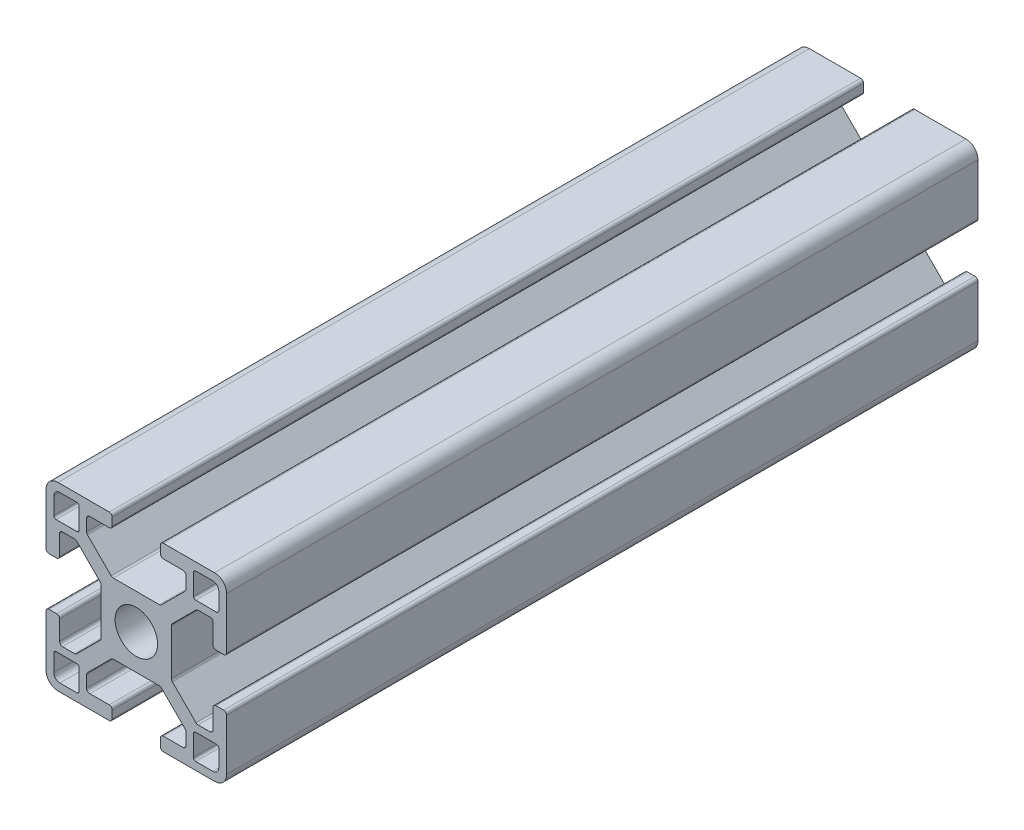
from build123d import *

# Parameters (mm, degrees)
SKETCH1_R           = 3.52998588
BOSS_EXTRUDE1_DEPTH = 62.39625


with BuildPart() as part:
    # Sketch1 → Boss-Extrude1 (new, symmetric)
    with BuildSketch(Plane.XY):
        with BuildLine():
            Line((14.49994, -4), (13.24247465, -4))
            ThreePointArc((13.24247465, -4), (12.88892126, -4.146446609), (12.74247465, -4.5))
            Line((12.74247465, -4.5), (12.74247465, -7.732519321))
            ThreePointArc((12.74247465, -7.732519321), (12.602449697, -8.097296796), (12.242781236, -8.249967))
            Line((12.242781236, -8.249967), (10.260188032, -8.249967))
            ThreePointArc((10.260188032, -8.249967), (10.068847082, -8.211906919), (9.906636056, -8.103520976))
            Line((9.906636056, -8.103520976), (5.981117769, -4.178002689))
            ThreePointArc((5.981117769, -4.178002689), (5.872731827, -4.015791664), (5.834671745, -3.824450713))
            Line((5.834671745, -3.824450713), (5.834671745, -1.01249595))
            Line((5.834671745, -1.01249595), (5.834671745, 0.88749645))
            Line((5.834671745, 0.88749645), (5.834671745, 3.824450713))
            ThreePointArc((5.834671745, 3.824450713), (5.872731827, 4.015791664), (5.981117769, 4.178002689))
            Line((5.981117769, 4.178002689), (9.906636056, 8.103520976))
            ThreePointArc((9.906636056, 8.103520976), (10.068847082, 8.211906919), (10.260188032, 8.249967))
            Line((10.260188032, 8.249967), (12.242781236, 8.249967))
            ThreePointArc((12.242781236, 8.249967), (12.602449697, 8.097296796), (12.74247465, 7.732519321))
            Line((12.74247465, 7.732519321), (12.74247465, 4.5))
            ThreePointArc((12.74247465, 4.5), (12.88892126, 4.146446609), (13.24247465, 4))
            Line((13.24247465, 4), (14.49994, 4))
            ThreePointArc((14.49994, 4), (14.853493391, 4.146446609), (14.99994, 4.5))
            Line((14.99994, 4.5), (14.99994, 12.999948))
            ThreePointArc((14.99994, 12.999948), (14.414155906, 14.414155906), (12.999948, 14.99994))
            Line((12.999948, 14.99994), (4.5, 14.99994))
            ThreePointArc((4.5, 14.99994), (4.146446609, 14.853493391), (4, 14.49994))
            Line((4, 14.49994), (4, 13.24247465))
            ThreePointArc((4, 13.24247465), (4.146446609, 12.88892126), (4.5, 12.74247465))
            Line((4.5, 12.74247465), (7.732519321, 12.74247465))
            ThreePointArc((7.732519321, 12.74247465), (8.097296796, 12.602449697), (8.249967, 12.242781236))
            Line((8.249967, 12.242781236), (8.249967, 10.260188032))
            ThreePointArc((8.249967, 10.260188032), (8.211906919, 10.068847082), (8.103520976, 9.906636056))
            Line((8.103520976, 9.906636056), (4.178002689, 5.981117769))
            ThreePointArc((4.178002689, 5.981117769), (4.015791664, 5.872731827), (3.824450713, 5.834671745))
            Line((3.824450713, 5.834671745), (0.9499962, 5.834671745))
            Line((0.9499962, 5.834671745), (-0.9499962, 5.834671745))
            Line((-0.9499962, 5.834671745), (-3.824450713, 5.834671745))
            ThreePointArc((-3.824450713, 5.834671745), (-4.015791664, 5.872731827), (-4.178002689, 5.981117769))
            Line((-4.178002689, 5.981117769), (-8.103520976, 9.906636056))
            ThreePointArc((-8.103520976, 9.906636056), (-8.211906919, 10.068847082), (-8.249967, 10.260188032))
            Line((-8.249967, 10.260188032), (-8.249967, 12.242781236))
            ThreePointArc((-8.249967, 12.242781236), (-8.097296796, 12.602449697), (-7.732519321, 12.74247465))
            Line((-7.732519321, 12.74247465), (-4.5, 12.74247465))
            ThreePointArc((-4.5, 12.74247465), (-4.146446609, 12.88892126), (-4, 13.24247465))
            Line((-4, 13.24247465), (-4, 14.49994))
            ThreePointArc((-4, 14.49994), (-4.146446609, 14.853493391), (-4.5, 14.99994))
            Line((-4.5, 14.99994), (-12.999948, 14.99994))
            ThreePointArc((-12.999948, 14.99994), (-14.414155906, 14.414155906), (-14.99994, 12.999948))
            Line((-14.99994, 12.999948), (-14.99994, 4.5))
            ThreePointArc((-14.99994, 4.5), (-14.853493391, 4.146446609), (-14.49994, 4))
            Line((-14.49994, 4), (-13.24247465, 4))
            ThreePointArc((-13.24247465, 4), (-12.88892126, 4.146446609), (-12.74247465, 4.5))
            Line((-12.74247465, 4.5), (-12.74247465, 7.732519321))
            ThreePointArc((-12.74247465, 7.732519321), (-12.602449697, 8.097296796), (-12.242781236, 8.249967))
            Line((-12.242781236, 8.249967), (-10.260188032, 8.249967))
            ThreePointArc((-10.260188032, 8.249967), (-10.068847082, 8.211906919), (-9.906636056, 8.103520976))
            Line((-9.906636056, 8.103520976), (-5.981117769, 4.178002689))
            ThreePointArc((-5.981117769, 4.178002689), (-5.872731827, 4.015791664), (-5.834671745, 3.824450713))
            Line((-5.834671745, 3.824450713), (-5.834671745, 0.88749645))
            Line((-5.834671745, 0.88749645), (-5.834671745, -1.01249595))
            Line((-5.834671745, -1.01249595), (-5.834671745, -3.824450713))
            ThreePointArc((-5.834671745, -3.824450713), (-5.872731827, -4.015791664), (-5.981117769, -4.178002689))
            Line((-5.981117769, -4.178002689), (-9.906636056, -8.103520976))
            ThreePointArc((-9.906636056, -8.103520976), (-10.068847082, -8.211906919), (-10.260188032, -8.249967))
            Line((-10.260188032, -8.249967), (-12.242781236, -8.249967))
            ThreePointArc((-12.242781236, -8.249967), (-12.602449697, -8.097296796), (-12.74247465, -7.732519321))
            Line((-12.74247465, -7.732519321), (-12.74247465, -4.5))
            ThreePointArc((-12.74247465, -4.5), (-12.88892126, -4.146446609), (-13.24247465, -4))
            Line((-13.24247465, -4), (-14.49994, -4))
            ThreePointArc((-14.49994, -4), (-14.853493391, -4.146446609), (-14.99994, -4.5))
            Line((-14.99994, -4.5), (-14.99994, -12.999948))
            ThreePointArc((-14.99994, -12.999948), (-14.414155906, -14.414155906), (-12.999948, -14.99994))
            Line((-12.999948, -14.99994), (-4.5, -14.99994))
            ThreePointArc((-4.5, -14.99994), (-4.146446609, -14.853493391), (-4, -14.49994))
            Line((-4, -14.49994), (-4, -13.24247465))
            ThreePointArc((-4, -13.24247465), (-4.146446609, -12.88892126), (-4.5, -12.74247465))
            Line((-4.5, -12.74247465), (-7.732519321, -12.74247465))
            ThreePointArc((-7.732519321, -12.74247465), (-8.097296796, -12.602449697), (-8.249967, -12.242781236))
            Line((-8.249967, -12.242781236), (-8.249967, -10.260188032))
            ThreePointArc((-8.249967, -10.260188032), (-8.211906919, -10.068847082), (-8.103520976, -9.906636056))
            Line((-8.103520976, -9.906636056), (-4.178002689, -5.981117769))
            ThreePointArc((-4.178002689, -5.981117769), (-4.015791664, -5.872731827), (-3.824450713, -5.834671745))
            Line((-3.824450713, -5.834671745), (-0.9499962, -5.834671745))
            Line((-0.9499962, -5.834671745), (0.9499962, -5.834671745))
            Line((0.9499962, -5.834671745), (3.824450713, -5.834671745))
            ThreePointArc((3.824450713, -5.834671745), (4.015791664, -5.872731827), (4.178002689, -5.981117769))
            Line((4.178002689, -5.981117769), (8.103520976, -9.906636056))
            ThreePointArc((8.103520976, -9.906636056), (8.211906919, -10.068847082), (8.249967, -10.260188032))
            Line((8.249967, -10.260188032), (8.249967, -12.242781236))
            ThreePointArc((8.249967, -12.242781236), (8.097296796, -12.602449697), (7.732519321, -12.74247465))
            Line((7.732519321, -12.74247465), (4.5, -12.74247465))
            ThreePointArc((4.5, -12.74247465), (4.146446609, -12.88892126), (4, -13.24247465))
            Line((4, -13.24247465), (4, -14.49994))
            ThreePointArc((4, -14.49994), (4.146446609, -14.853493391), (4.5, -14.99994))
            Line((4.5, -14.99994), (12.999948, -14.99994))
            ThreePointArc((12.999948, -14.99994), (14.414155906, -14.414155906), (14.99994, -12.999948))
            Line((14.99994, -12.999948), (14.99994, -4.5))
            ThreePointArc((14.99994, -4.5), (14.853493391, -4.146446609), (14.49994, -4))
        make_face()
        Circle(SKETCH1_R, mode=Mode.SUBTRACT)
        with BuildLine():
            Line((-12.6999492, -13.6999452), (-9.880960476, -13.6999452))
            ThreePointArc((-9.880960476, -13.6999452), (-9.61155387, -13.58835333), (-9.499962, -13.318946724))
            Line((-9.499962, -13.318946724), (-9.499962, -9.87996048))
            ThreePointArc((-9.499962, -9.87996048), (-9.611260978, -9.611260978), (-9.87996048, -9.499962))
            Line((-9.87996048, -9.499962), (-13.318946724, -9.499962))
            ThreePointArc((-13.318946724, -9.499962), (-13.58835333, -9.61155387), (-13.6999452, -9.880960476))
            Line((-13.6999452, -9.880960476), (-13.6999452, -12.6999492))
            ThreePointArc((-13.6999452, -12.6999492), (-13.407053153, -13.407053153), (-12.6999492, -13.6999452))
        make_face(mode=Mode.SUBTRACT)
        with BuildLine():
            Line((13.6999452, -12.6999492), (13.6999452, -9.880960476))
            ThreePointArc((13.6999452, -9.880960476), (13.58835333, -9.61155387), (13.318946724, -9.499962))
            Line((13.318946724, -9.499962), (9.87996048, -9.499962))
            ThreePointArc((9.87996048, -9.499962), (9.611260978, -9.611260978), (9.499962, -9.87996048))
            Line((9.499962, -9.87996048), (9.499962, -13.318946724))
            ThreePointArc((9.499962, -13.318946724), (9.61155387, -13.58835333), (9.880960476, -13.6999452))
            Line((9.880960476, -13.6999452), (12.6999492, -13.6999452))
            ThreePointArc((12.6999492, -13.6999452), (13.407053153, -13.407053153), (13.6999452, -12.6999492))
        make_face(mode=Mode.SUBTRACT)
        with BuildLine():
            Line((9.87996048, 9.499962), (13.318946724, 9.499962))
            ThreePointArc((13.318946724, 9.499962), (13.58835333, 9.61155387), (13.6999452, 9.880960476))
            Line((13.6999452, 9.880960476), (13.6999452, 12.6999492))
            ThreePointArc((13.6999452, 12.6999492), (13.407053153, 13.407053153), (12.6999492, 13.6999452))
            Line((12.6999492, 13.6999452), (9.880960476, 13.6999452))
            ThreePointArc((9.880960476, 13.6999452), (9.61155387, 13.58835333), (9.499962, 13.318946724))
            Line((9.499962, 13.318946724), (9.499962, 9.87996048))
            ThreePointArc((9.499962, 9.87996048), (9.611260978, 9.611260978), (9.87996048, 9.499962))
        make_face(mode=Mode.SUBTRACT)
        with BuildLine():
            Line((-13.6999452, 12.6999492), (-13.6999452, 9.880960476))
            ThreePointArc((-13.6999452, 9.880960476), (-13.58835333, 9.61155387), (-13.318946724, 9.499962))
            Line((-13.318946724, 9.499962), (-9.87996048, 9.499962))
            ThreePointArc((-9.87996048, 9.499962), (-9.611260978, 9.611260978), (-9.499962, 9.87996048))
            Line((-9.499962, 9.87996048), (-9.499962, 13.318946724))
            ThreePointArc((-9.499962, 13.318946724), (-9.61155387, 13.58835333), (-9.880960476, 13.6999452))
            Line((-9.880960476, 13.6999452), (-12.6999492, 13.6999452))
            ThreePointArc((-12.6999492, 13.6999452), (-13.407053153, 13.407053153), (-13.6999452, 12.6999492))
        make_face(mode=Mode.SUBTRACT)
    extrude(amount=BOSS_EXTRUDE1_DEPTH, both=True)


solid = part.part
